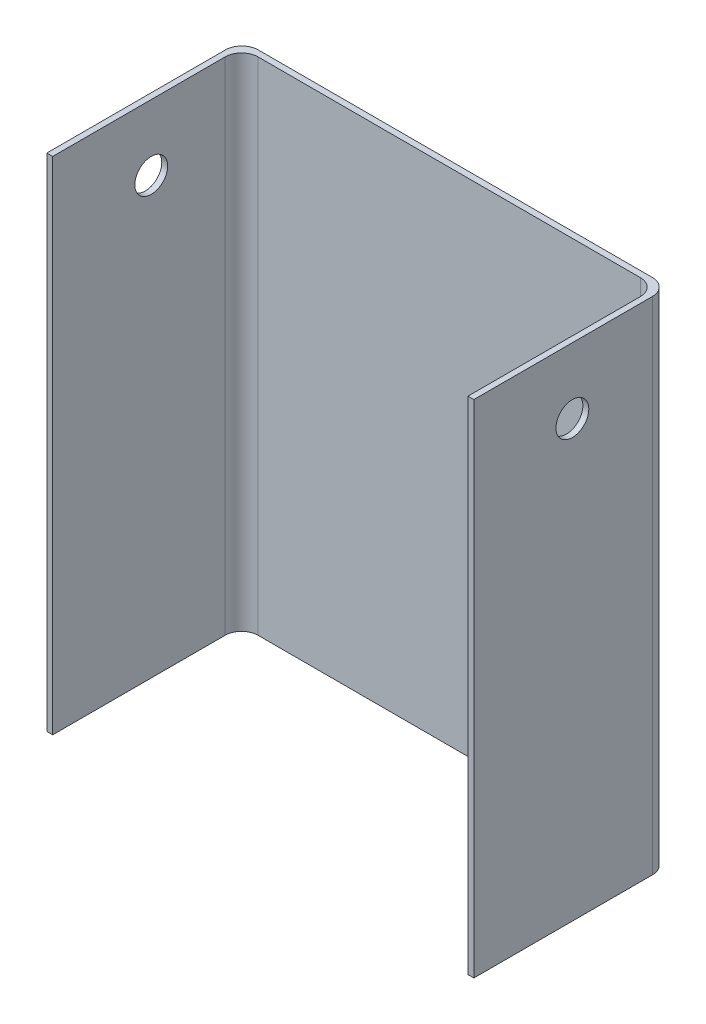
from build123d import *

# Parameters (mm, degrees)
SKETCH1_W           = 66.04
SKETCH1_H           = 77.47
BOSS_EXTRUDE1_DEPTH = 30.1625
SKETCH2_W           = 64.21628
SKETCH2_H           = 77.47
CUT_EXTRUDE2_DEPTH  = 29.21
FILLET1_R           = 2.54
FILLET2_R           = 2.54
FILLET3_R           = 2.54
FILLET4_R           = 2.54
SKETCH5_R           = 2.54
CUT_EXTRUDE3_DEPTH  = 94.650885895


with BuildPart() as part:
    # Sketch1 → Boss-Extrude1 (new body)
    with BuildSketch(Plane.XY):
        with Locations((54.726493431, 20.420983827)):
            Rectangle(SKETCH1_W, SKETCH1_H)
    extrude(amount=BOSS_EXTRUDE1_DEPTH)

    # Sketch2 → Cut-Extrude2 (cut)
    with BuildSketch(Plane.XY.offset(30.1625)):
        with Locations((54.726493431, 20.420983827)):
            Rectangle(SKETCH2_W, SKETCH2_H)
    extrude(amount=-CUT_EXTRUDE2_DEPTH, mode=Mode.SUBTRACT)

    # Fillet1
    fillet1_edges = [part.edges().sort_by_distance(p)[0] for p in [
        (21.706493431, 20.420983827, 0),
    ]]
    fillet(fillet1_edges, radius=FILLET1_R)

    # Fillet2
    fillet2_edges = [part.edges().sort_by_distance(p)[0] for p in [
        (87.746493431, 20.420983827, 0),
    ]]
    fillet(fillet2_edges, radius=FILLET2_R)

    # Fillet3
    fillet3_edges = [part.edges().sort_by_distance(p)[0] for p in [
        (22.618353431, 20.420983827, 0.9525),
    ]]
    fillet(fillet3_edges, radius=FILLET3_R)

    # Fillet4
    fillet4_edges = [part.edges().sort_by_distance(p)[0] for p in [
        (86.834633431, 20.420983827, 0.9525),
    ]]
    fillet(fillet4_edges, radius=FILLET4_R)

    # Sketch5 → Cut-Extrude3 (cut, through all)
    with BuildSketch(Plane.ZY.offset(-21.706493431)):
        with Locations(Location((14.9225, 48.995983827, 0), (0, 0, 270))):
            Circle(SKETCH5_R)
    extrude(amount=-CUT_EXTRUDE3_DEPTH, mode=Mode.SUBTRACT)


solid = part.part
